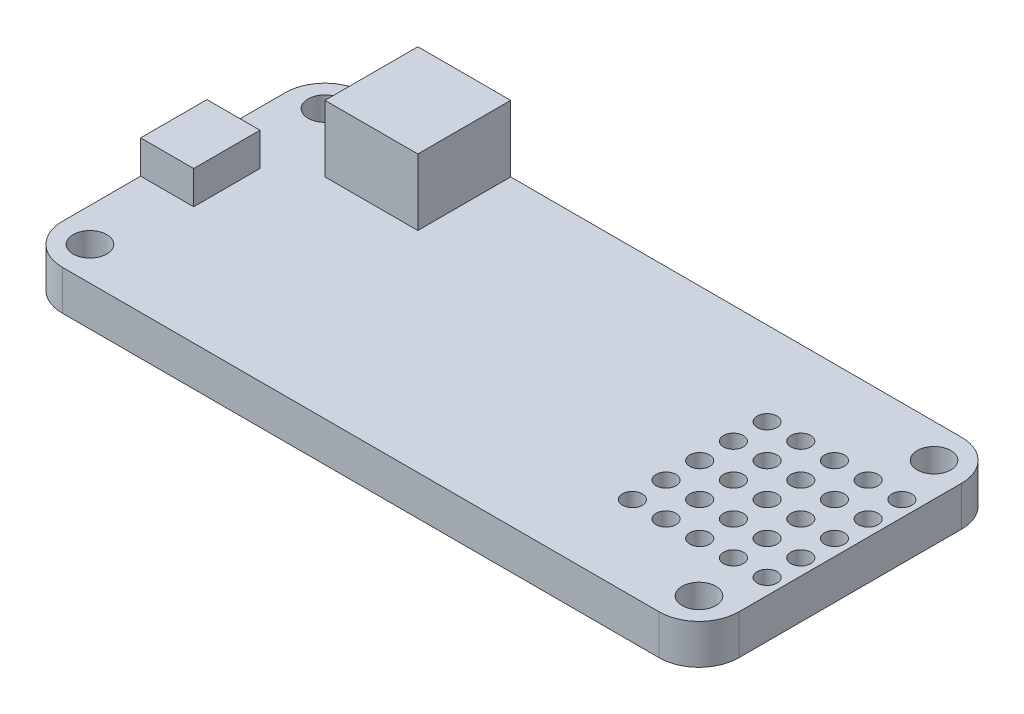
from build123d import *

# Parameters (mm, degrees)
SKETCH1_W           = 51
SKETCH1_H           = 22.8
BOSS_EXTRUDE1_DEPTH = 3
SKETCH2_W           = 4
SKETCH2_H           = 5
BOSS_EXTRUDE2_DEPTH = 2.5
SKETCH3_W           = 7
SKETCH3_H           = 7
BOSS_EXTRUDE3_DEPTH = 5
SKETCH4_R           = 1.27
CUT_EXTRUDE1_DEPTH  = 57.087788332
FILLET1_R           = 3
SKETCH5_R           = 0.75
CUT_EXTRUDE2_DEPTH  = 57.087788332


with BuildPart() as part:
    # Sketch1 → Boss-Extrude1 (new body)
    with BuildSketch(Plane(origin=(0, 0, 0), x_dir=(1, 0, 0), z_dir=(0, 1, 0))):
        with Locations((25.5, 11.4)):
            Rectangle(SKETCH1_W, SKETCH1_H)
    extrude(amount=BOSS_EXTRUDE1_DEPTH)

    # Sketch2 → Boss-Extrude2 (add)
    with BuildSketch(Plane(origin=(0, 3, 0), x_dir=(1, 0, 0), z_dir=(0, 1, 0))):
        with Locations((2, 11.4)):
            Rectangle(SKETCH2_W, SKETCH2_H)
    extrude(amount=BOSS_EXTRUDE2_DEPTH)

    # Sketch3 → Boss-Extrude3 (add)
    with BuildSketch(Plane(origin=(0, 3, 0), x_dir=(1, 0, 0), z_dir=(0, 1, 0))):
        with Locations((10.5, 19.3)):
            Rectangle(SKETCH3_W, SKETCH3_H)
    extrude(amount=BOSS_EXTRUDE3_DEPTH)

    # Sketch4 → Cut-Extrude1 (cut, through all)
    with BuildSketch(Plane(origin=(0, 3, 0), x_dir=(1, 0, 0), z_dir=(0, 1, 0))):
        with Locations(Location((2.54, 20.26, 0), (0, 0, 270))):
            Circle(SKETCH4_R)
        with Locations(Location((2.54, 2.54, 0), (0, 0, 270))):
            Circle(SKETCH4_R)
        with Locations(Location((48.46, 20.26, 0), (0, 0, 270))):
            Circle(SKETCH4_R)
        with Locations(Location((48.46, 2.54, 0), (0, 0, 270))):
            Circle(SKETCH4_R)
    extrude(amount=-CUT_EXTRUDE1_DEPTH, mode=Mode.SUBTRACT)

    # Fillet1
    fillet1_edges = [part.edges().sort_by_distance(p)[0] for p in [
        (0, 1.5, 0),
        (0, 1.5, -22.8),
        (51, 1.5, -22.8),
        (51, 1.5, 0),
    ]]
    fillet(fillet1_edges, radius=FILLET1_R)

    # Sketch5 → Cut-Extrude2 (cut, through all)
    with BuildSketch(Plane(origin=(0, 3, 0), x_dir=(1, 0, 0), z_dir=(0, 1, 0))):
        with Locations(Location((47.27309584, 6.32, 0), (0, 0, 270))):
            Circle(SKETCH5_R)
        with Locations(Location((49.81309584, 8.86, 0), (0, 0, 270))):
            Circle(SKETCH5_R)
        with Locations(Location((44.73309584, 16.48, 0), (0, 0, 270))):
            Circle(SKETCH5_R)
        with Locations(Location((39.65309584, 6.32, 0), (0, 0, 270))):
            Circle(SKETCH5_R)
        with Locations(Location((42.19309584, 6.32, 0), (0, 0, 270))):
            Circle(SKETCH5_R)
        with Locations(Location((44.73309584, 6.32, 0), (0, 0, 270))):
            Circle(SKETCH5_R)
        with Locations(Location((49.81309584, 6.32, 0), (0, 0, 270))):
            Circle(SKETCH5_R)
        with Locations(Location((47.27309584, 8.86, 0), (0, 0, 270))):
            Circle(SKETCH5_R)
        with Locations(Location((44.73309584, 8.86, 0), (0, 0, 270))):
            Circle(SKETCH5_R)
        with Locations(Location((42.19309584, 8.86, 0), (0, 0, 270))):
            Circle(SKETCH5_R)
        with Locations(Location((39.65309584, 8.86, 0), (0, 0, 270))):
            Circle(SKETCH5_R)
        with Locations(Location((39.65309584, 11.4, 0), (0, 0, 270))):
            Circle(SKETCH5_R)
        with Locations(Location((42.19309584, 11.4, 0), (0, 0, 270))):
            Circle(SKETCH5_R)
        with Locations(Location((44.73309584, 11.4, 0), (0, 0, 270))):
            Circle(SKETCH5_R)
        with Locations(Location((47.27309584, 11.4, 0), (0, 0, 270))):
            Circle(SKETCH5_R)
        with Locations(Location((49.81309584, 11.4, 0), (0, 0, 270))):
            Circle(SKETCH5_R)
        with Locations(Location((49.81309584, 13.94, 0), (0, 0, 270))):
            Circle(SKETCH5_R)
        with Locations(Location((47.27309584, 13.94, 0), (0, 0, 270))):
            Circle(SKETCH5_R)
        with Locations(Location((44.73309584, 13.94, 0), (0, 0, 270))):
            Circle(SKETCH5_R)
        with Locations(Location((42.19309584, 13.94, 0), (0, 0, 270))):
            Circle(SKETCH5_R)
        with Locations(Location((39.65309584, 13.94, 0), (0, 0, 270))):
            Circle(SKETCH5_R)
        with Locations(Location((39.65309584, 16.48, 0), (0, 0, 270))):
            Circle(SKETCH5_R)
        with Locations(Location((42.19309584, 16.48, 0), (0, 0, 270))):
            Circle(SKETCH5_R)
        with Locations(Location((47.27309584, 16.48, 0), (0, 0, 270))):
            Circle(SKETCH5_R)
        with Locations(Location((49.81309584, 16.48, 0), (0, 0, 270))):
            Circle(SKETCH5_R)
    extrude(amount=-CUT_EXTRUDE2_DEPTH, mode=Mode.SUBTRACT)


solid = part.part
